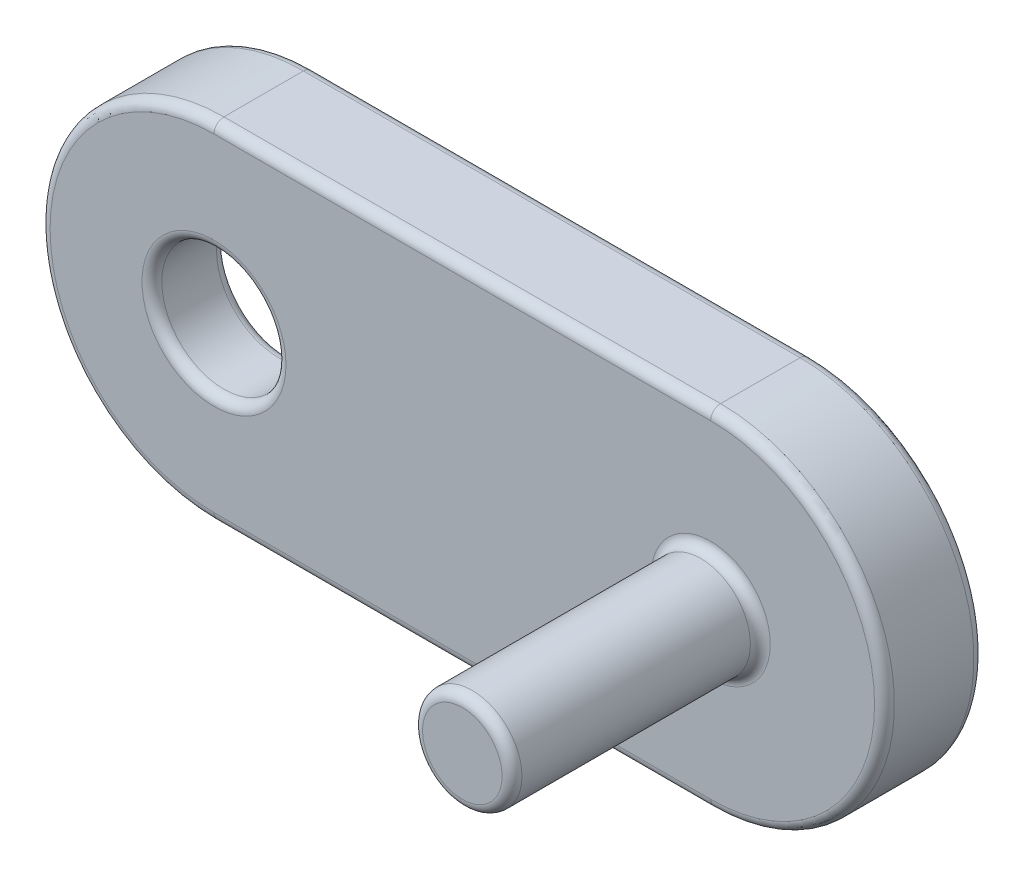
from build123d import *

# Parameters (mm, degrees)
EXTRUSION1_DEPTH        = 2
ENL_V_MAT_EXTRU_1_DEPTH = 0.5
ESQUISSE3_R             = 1.25
ENL_V_MAT_EXTRU_2_DEPTH = 10.313968005
ESQUISSE4_R             = 1
EXTRUSION2_DEPTH        = 5
CONG_1_R                = 0.2


with BuildPart() as part:
    # Esquisse1 → Extrusion1 (new body)
    with BuildSketch(Plane.XY):
        with BuildLine():
            Line((-5, 3.5), (5, 3.5))
            ThreePointArc((5, 3.5), (8.5, 0), (5, -3.5))
            Line((5, -3.5), (-5, -3.5))
            ThreePointArc((-5, -3.5), (-8.5, 0), (-5, 3.5))
        make_face()
    extrude(amount=EXTRUSION1_DEPTH)

    # Esquisse2 → Enlèv. mat.-Extru.1 (cut)
    with BuildSketch(Plane(origin=(0, 0, 0), x_dir=(-1, 0, 0), z_dir=(0, 0, -1))):
        with BuildLine():
            Line((5, 3), (-5, 3))
            ThreePointArc((-5, 3), (-8, 0), (-5, -3))
            Line((-5, -3), (5, -3))
            ThreePointArc((5, -3), (8, 0), (5, 3))
        make_face()
    extrude(amount=-ENL_V_MAT_EXTRU_1_DEPTH, mode=Mode.SUBTRACT)

    # Esquisse3 → Enlèv. mat.-Extru.2 (cut, through all)
    with BuildSketch(Plane(origin=(0, 0, 0.5), x_dir=(-1, 0, 0), z_dir=(0, 0, -1))):
        with Locations((5, 0)):
            Circle(ESQUISSE3_R)
    extrude(amount=-ENL_V_MAT_EXTRU_2_DEPTH, mode=Mode.SUBTRACT)

    # Esquisse4 → Extrusion2 (add)
    with BuildSketch(Plane.XY.offset(2)):
        with Locations((5, 0)):
            Circle(ESQUISSE4_R)
    extrude(amount=EXTRUSION2_DEPTH)

    # Congé1
    cong_1_edges = [part.edges().sort_by_distance(p)[0] for p in [
        (0, 3.5, 0),
        (0, 3.5, 2),
        (-8.5, 0, 0),
        (-8.5, 0, 2),
        (8.5, 0, 0),
        (8.5, 0, 2),
        (0, -3.5, 0),
        (0, 3, 0),
        (8, 0, 0),
        (0, -3, 0),
        (-8, 0, 0),
        (0, -3.5, 2),
        (4, 0, 2),
        (-3.75, 0, 2),
        (0, 3, 0.5),
        (8, 0, 0.5),
        (0, -3, 0.5),
        (-8, 0, 0.5),
        (4, 0, 7),
        (-3.75, 0, 0.5),
    ]]
    fillet(cong_1_edges, radius=CONG_1_R)


solid = part.part
